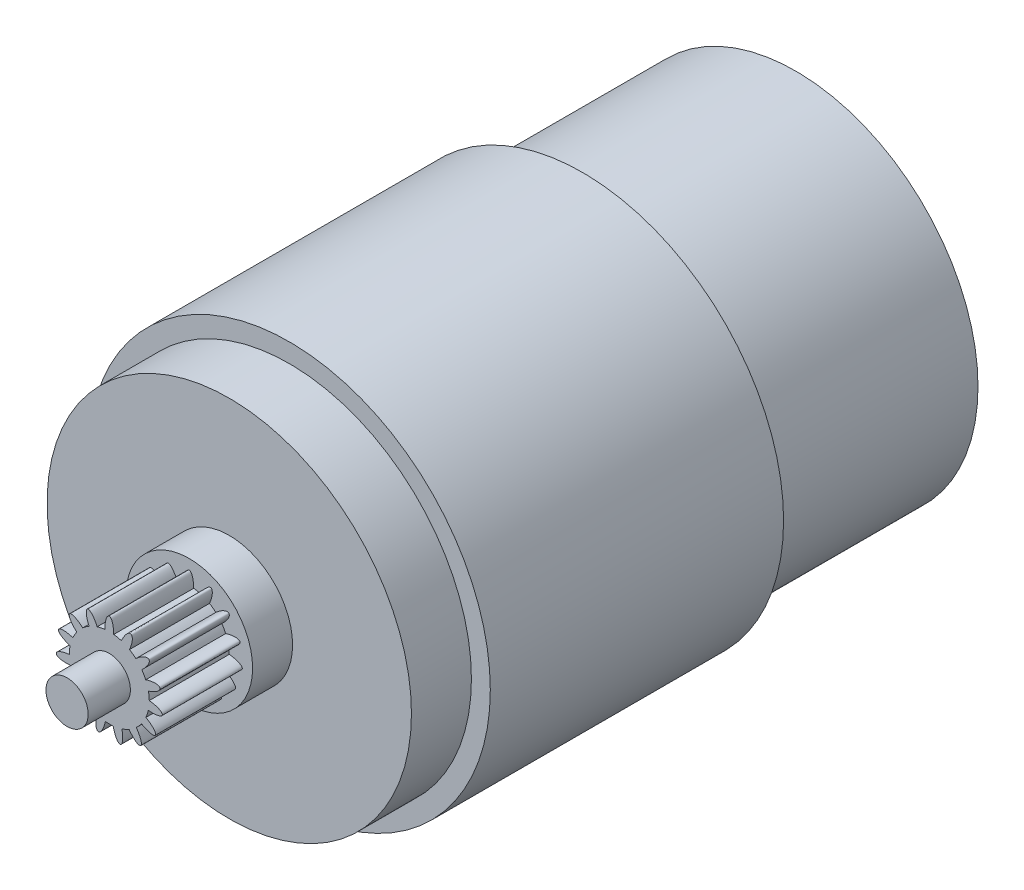
from build123d import *

# Parameters (mm, degrees)
SKETCH1_R           = 22.987
BOSS_EXTRUDE1_DEPTH = 16.764
SKETCH2_R           = 20.828
BOSS_EXTRUDE2_DEPTH = 24.384
SKETCH3_R           = 7.366
BOSS_EXTRUDE3_DEPTH = 4.318
BOSS_EXTRUDE4_START = 6.858
SKETCH4_R           = 20.828
BOSS_EXTRUDE4_DEPTH = 6.858
SKETCH5_R           = 7.239
BOSS_EXTRUDE5_DEPTH = 4.572
SKETCH6_R           = 2.413
BOSS_EXTRUDE6_DEPTH = 13.97
SKETCH7_R           = 4.572
BOSS_EXTRUDE7_DEPTH = 9.144
SKETCH8_RX          = 1.524
SKETCH8_RY          = 0.508
BOSS_EXTRUDE8_DEPTH = 9.144
CIRPATTERN1_COUNT   = 15


with BuildPart() as part:
    # Sketch1 → Boss-Extrude1 (new, symmetric)
    with BuildSketch(Plane.XY):
        Circle(SKETCH1_R)
    extrude(amount=BOSS_EXTRUDE1_DEPTH, both=True)

    # Sketch2 → Boss-Extrude2 (add)
    with BuildSketch(Plane(origin=(0, 0, -16.764), x_dir=(-1, 0, 0), z_dir=(0, 0, -1))):
        with Locations(Location((0, 0, 0), (0, 0, 180))):
            Circle(SKETCH2_R)
    extrude(amount=BOSS_EXTRUDE2_DEPTH)

    # Sketch3 → Boss-Extrude3 (add)
    with BuildSketch(Plane(origin=(0, 0, -41.148), x_dir=(-1, 0, 0), z_dir=(0, 0, -1))):
        Circle(SKETCH3_R)
    extrude(amount=BOSS_EXTRUDE3_DEPTH)

    # Sketch4 → Boss-Extrude4 (add)
    with BuildSketch(Plane.XY.offset(16.764).offset(BOSS_EXTRUDE4_START)):
        Circle(SKETCH4_R)
    extrude(amount=-BOSS_EXTRUDE4_DEPTH)

    # Sketch5 → Boss-Extrude5 (add)
    with BuildSketch(Plane.XY.offset(23.622)):
        Circle(SKETCH5_R)
    extrude(amount=BOSS_EXTRUDE5_DEPTH)

    # Sketch6 → Boss-Extrude6 (add)
    with BuildSketch(Plane.XY.offset(28.194)):
        Circle(SKETCH6_R)
    extrude(amount=BOSS_EXTRUDE6_DEPTH)

    # Sketch7 → Boss-Extrude7 (add)
    with BuildSketch(Plane.XY.offset(28.194)):
        with Locations(Location((0, 0, 0), (0, 0, 180))):
            Circle(SKETCH7_R)
    extrude(amount=BOSS_EXTRUDE7_DEPTH)

    # Sketch8 → Boss-Extrude8 (add)
    with BuildSketch(Plane.XY.offset(28.194)):
        with Locations(Location((0, 4.572), (0, 0, 90))):
            Ellipse(SKETCH8_RX, SKETCH8_RY)
    boss_extrude8 = extrude(amount=BOSS_EXTRUDE8_DEPTH)

    # CirPattern1: Boss-Extrude8 ×15 about axis
    cirpattern1_axis = Axis((0, 0, -49.8475), (0, 0, 1))
    for i in range(1, CIRPATTERN1_COUNT):
        add(boss_extrude8.rotate(cirpattern1_axis, i * 360 / CIRPATTERN1_COUNT))


solid = part.part
